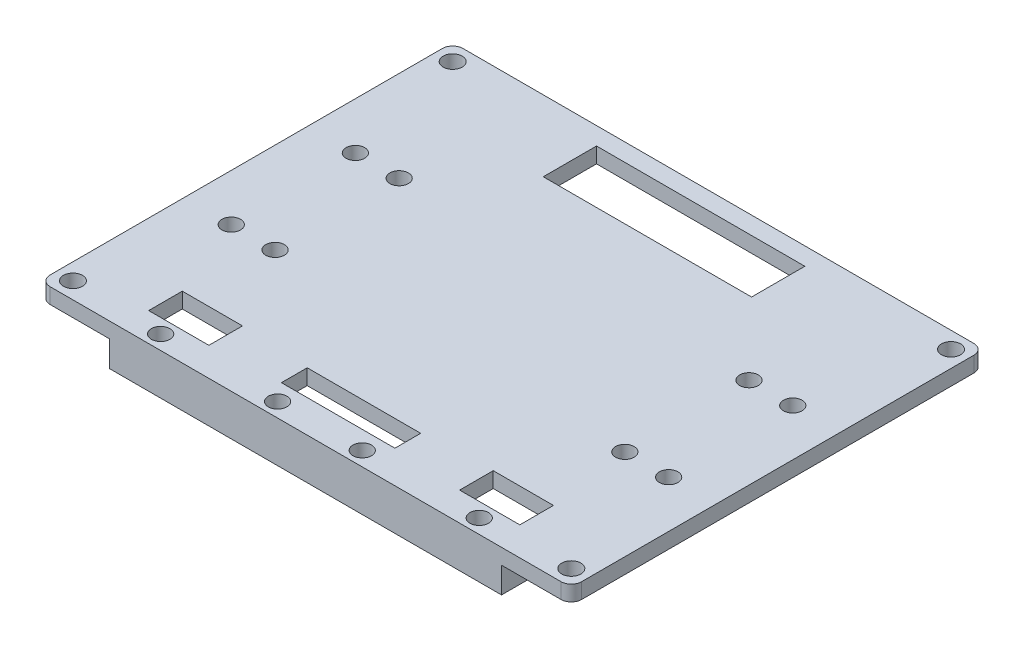
from build123d import *

# Parameters (mm, degrees)
SKETCH_1_R          = 1.85
SKETCH_1_R_2        = 1.8
SKETCH_1_W          = 40.374860346
SKETCH_1_H          = 10.321291022
SKETCH_1_W_2        = 22
SKETCH_1_H_2        = 5
SKETCH_1_W_3        = 11.667697598
SKETCH_1_H_3        = 6.517356375
EXTRUDE_1_DEPTH     = 3
SKETCH_2_W          = 75.93825213
SKETCH_2_H          = 5.545458332
EXTRUDE_2_DEPTH     = 8
SKETCH_3_R          = 1.8
CUT_EXTRUDE_1_DEPTH = 15


with BuildPart() as part:
    # 草图1 → 凸台-拉伸1 (new body)
    with BuildSketch(Plane(origin=(0, 0, 0), x_dir=(1, 0, 0), z_dir=(0, 1, 0))):
        with BuildLine():
            Line((49.5, -40), (-49.5, -40))
            ThreePointArc((-49.5, -40), (-50.914213562, -39.414213562), (-51.5, -38))
            Line((-51.5, -38), (-51.5, 38))
            ThreePointArc((-51.5, 38), (-50.914213562, 39.414213562), (-49.5, 40))
            Line((-49.5, 40), (49.5, 40))
            ThreePointArc((49.5, 40), (50.914213562, 39.414213562), (51.5, 38))
            Line((51.5, 38), (51.5, -38))
            ThreePointArc((51.5, -38), (50.914213562, -39.414213562), (49.5, -40))
        make_face()
        with Locations(Location((-48.296806281, 36.796806281, 0), (0, 0, 270))):
            Circle(SKETCH_1_R, mode=Mode.SUBTRACT)
        with Locations(Location((48.296806281, 36.796806281, 0), (0, 0, 270))):
            Circle(SKETCH_1_R, mode=Mode.SUBTRACT)
        with Locations(Location((48.296806281, -36.796806281, 0), (0, 0, 270))):
            Circle(SKETCH_1_R, mode=Mode.SUBTRACT)
        with Locations(Location((-48.296806281, -36.796806281, 0), (0, 0, 270))):
            Circle(SKETCH_1_R, mode=Mode.SUBTRACT)
        with Locations(Location((-42.391806281, 12.03, 0), (0, 0, 270))):
            Circle(SKETCH_1_R_2, mode=Mode.SUBTRACT)
        with Locations(Location((-33.901806281, 12.03, 0), (0, 0, 270))):
            Circle(SKETCH_1_R_2, mode=Mode.SUBTRACT)
        with Locations(Location((-33.901806281, -12.03, 0), (0, 0, 270))):
            Circle(SKETCH_1_R_2, mode=Mode.SUBTRACT)
        with Locations(Location((-42.391806281, -12.03, 0), (0, 0, 270))):
            Circle(SKETCH_1_R_2, mode=Mode.SUBTRACT)
        with Locations(Location((33.901806281, -12.03, 0), (0, 0, 270))):
            Circle(SKETCH_1_R_2, mode=Mode.SUBTRACT)
        with Locations(Location((42.391806281, -12.03, 0), (0, 0, 270))):
            Circle(SKETCH_1_R_2, mode=Mode.SUBTRACT)
        with Locations(Location((33.901806281, 12.03, 0), (0, 0, 270))):
            Circle(SKETCH_1_R_2, mode=Mode.SUBTRACT)
        with Locations(Location((42.391806281, 12.03, 0), (0, 0, 270))):
            Circle(SKETCH_1_R_2, mode=Mode.SUBTRACT)
        with Locations((0, 31.409786363)):
            Rectangle(SKETCH_1_W, SKETCH_1_H, mode=Mode.SUBTRACT)
        with Locations((0, -31.19586348)):
            Rectangle(SKETCH_1_W_2, SKETCH_1_H_2, mode=Mode.SUBTRACT)
        with Locations((30.135277266, -31.195863481)):
            Rectangle(SKETCH_1_W_3, SKETCH_1_H_3, mode=Mode.SUBTRACT)
        with Locations((-30.135277266, -31.195863481)):
            Rectangle(SKETCH_1_W_3, SKETCH_1_H_3, mode=Mode.SUBTRACT)
    extrude(amount=EXTRUDE_1_DEPTH)

    # 草图2 → 凸台-拉伸2 (add)
    with BuildSketch(Plane(origin=(0, 3, 0), x_dir=(1, 0, 0), z_dir=(0, 1, 0))):
        with Locations((0, -37.227270834)):
            Rectangle(SKETCH_2_W, SKETCH_2_H)
    extrude(amount=-EXTRUDE_2_DEPTH)

    # 草图3 → 切除-拉伸1 (cut)
    with BuildSketch(Plane(origin=(0, -5, 0), x_dir=(-1, 0, 0), z_dir=(0, -1, 0))):
        with Locations(Location((30.875113943, -37.227270834, 0), (0, 0, 90))):
            Circle(SKETCH_3_R)
        with BuildLine():
            ThreePointArc((10, -37.227270834), (8.2, -35.427270834), (6.4, -37.227270834))
            Line((6.4, -37.227270834), (10, -37.227270834))
        make_face()
        with BuildLine():
            Line((10, -37.227270834), (6.4, -37.227270834))
            ThreePointArc((6.4, -37.227270834), (8.2, -39.027270834), (10, -37.227270834))
        make_face()
        with BuildLine():
            ThreePointArc((-10, -37.227270834), (-8.2, -39.027270834), (-6.4, -37.227270834))
            Line((-6.4, -37.227270834), (-10, -37.227270834))
        make_face()
        with BuildLine():
            Line((-10, -37.227270834), (-6.4, -37.227270834))
            ThreePointArc((-6.4, -37.227270834), (-8.2, -35.427270834), (-10, -37.227270834))
        make_face()
        with Locations(Location((-30.875113943, -37.227270834, 0), (0, 0, 90))):
            Circle(SKETCH_3_R)
    extrude(amount=-CUT_EXTRUDE_1_DEPTH, mode=Mode.SUBTRACT)


solid = part.part
